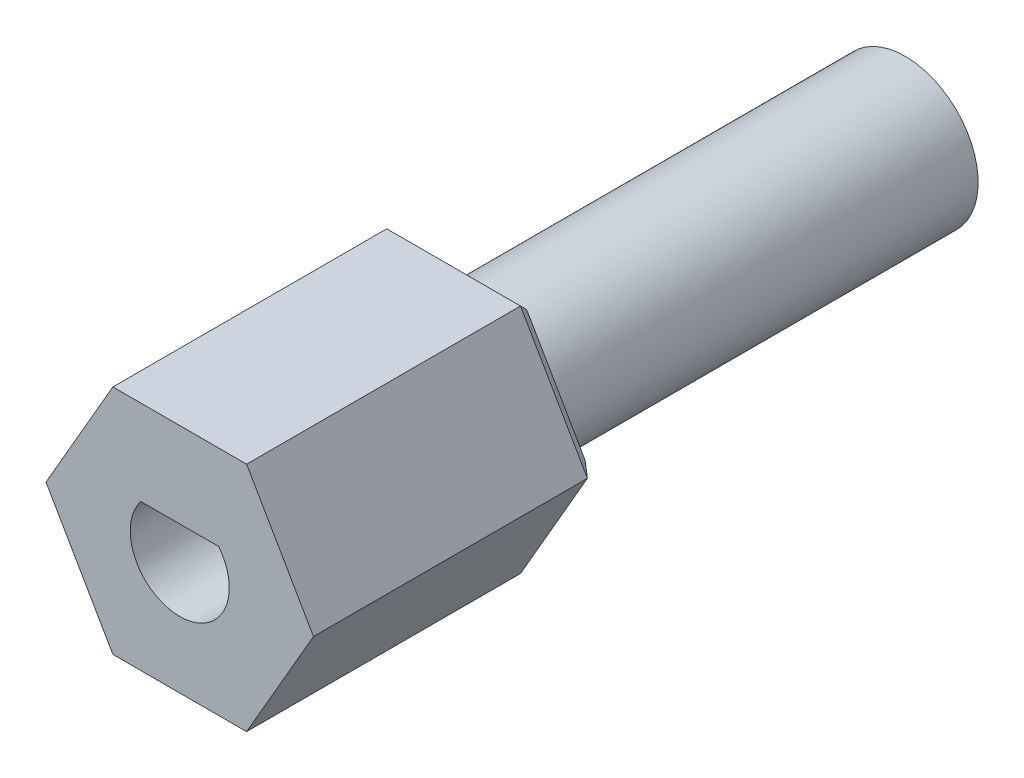
from build123d import *

# Parameters (mm, degrees)
SALIENTE_EXTRUIR1_DEPTH = 9.9
CORTAR_EXTRUIR1_DEPTH   = 8
CROQUIS3_R              = 2.5
SALIENTE_EXTRUIR2_DEPTH = 15
CROQUIS4_R              = 1.45
CORTAR_EXTRUIR2_DEPTH   = 14
CHAFL_N1_SIZE           = 0.5
CHAFL_N2_SIZE           = 0.5


with BuildPart() as part:
    # Croquis1 → Saliente-Extruir1 (new body)
    with BuildSketch(Plane.XY):
        Polygon((4.58993464, 0), (2.29496732, 3.975), (-2.29496732, 3.975), (-4.58993464, 0), (-2.29496732, -3.975), (2.29496732, -3.975), align=None)
    extrude(amount=SALIENTE_EXTRUIR1_DEPTH)

    # Croquis2 → Cortar-Extruir1 (cut)
    with BuildSketch(Plane.XY.offset(9.9)):
        with BuildLine():
            Line((-1.336974196, 1.05), (1.336974196, 1.05))
            ThreePointArc((1.336974196, 1.05), (0, -1.7), (-1.336974196, 1.05))
        make_face()
    extrude(amount=-CORTAR_EXTRUIR1_DEPTH, mode=Mode.SUBTRACT)

    # Croquis3 → Saliente-Extruir2 (add)
    with BuildSketch(Plane(origin=(0, 0, 0), x_dir=(-1, 0, 0), z_dir=(0, 0, -1))):
        Circle(CROQUIS3_R)
    extrude(amount=SALIENTE_EXTRUIR2_DEPTH)

    # Croquis4 → Cortar-Extruir2 (cut)
    with BuildSketch(Plane(origin=(0, 0, -15), x_dir=(-1, 0, 0), z_dir=(0, 0, -1))):
        Circle(CROQUIS4_R)
    extrude(amount=-CORTAR_EXTRUIR2_DEPTH, mode=Mode.SUBTRACT)

    # Chaflán1
    chafl_n1_edges = [part.edges().sort_by_distance(p)[0] for p in [
        (0, -3.975, 0),
        (-3.44245098, -1.9875, 0),
        (-3.44245098, 1.9875, 0),
        (0, 3.975, 0),
        (3.44245098, 1.9875, 0),
        (3.44245098, -1.9875, 0),
    ]]
    chamfer(chafl_n1_edges, length=CHAFL_N1_SIZE)

    # Chaflán2
    chafl_n2_edges = [part.edges().sort_by_distance(p)[0] for p in [
        (1.45, 0, -15),
    ]]
    chamfer(chafl_n2_edges, length=CHAFL_N2_SIZE)


solid = part.part
